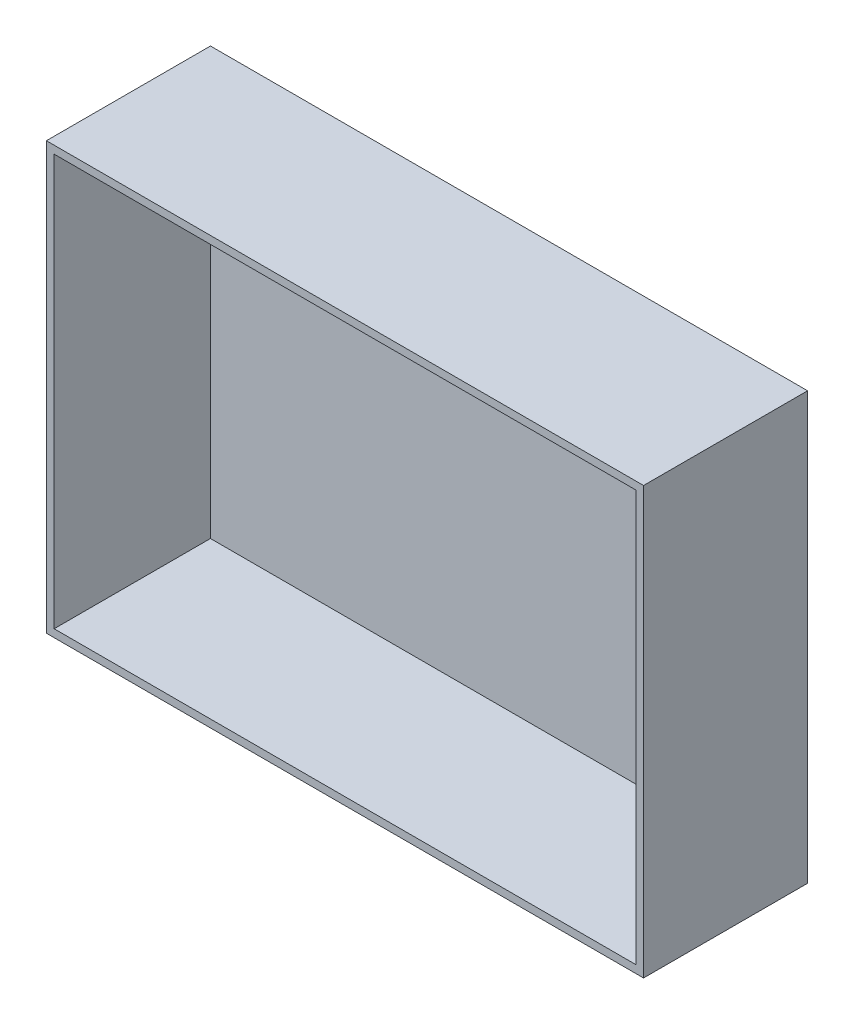
from build123d import *

# Parameters (mm, degrees)
SKETCH1_W           = 231.14
SKETCH1_H           = 165.1
BOSS_EXTRUDE1_DEPTH = 63.5
SKETCH2_OUTSIDE_W   = 291.352
SKETCH2_OUTSIDE_H   = 225.312
SKETCH2_OUTSIDE_W_2 = 231.14
SKETCH2_OUTSIDE_H_2 = 165.1
SKETCH2_OUTSIDE_W_3 = 225.14
SKETCH2_OUTSIDE_H_3 = 159.1
CUT_EXTRUDE1_DEPTH  = 60.5


with BuildPart() as part:
    # Sketch1 → Boss-Extrude1 (new body)
    with BuildSketch(Plane.XY):
        with Locations((115.57, 82.55)):
            Rectangle(SKETCH1_W, SKETCH1_H)
    extrude(amount=BOSS_EXTRUDE1_DEPTH)

    # Sketch2 outside → Cut-Extrude1 (cut)
    # profile 1 of 2: a face of its own
    with BuildSketch(Plane.XY.offset(63.5)):
        with Locations((115.57, 82.55)):
            Rectangle(SKETCH2_OUTSIDE_W, SKETCH2_OUTSIDE_H)
        with Locations((115.57, 82.55)):
            Rectangle(SKETCH2_OUTSIDE_W_2, SKETCH2_OUTSIDE_H_2, mode=Mode.SUBTRACT)
    # profile 2 of 2: a face of its own
    with BuildSketch(Plane.XY.offset(63.5)):
        with Locations((115.57, 82.55)):
            Rectangle(SKETCH2_OUTSIDE_W_3, SKETCH2_OUTSIDE_H_3)
    extrude(amount=-CUT_EXTRUDE1_DEPTH, mode=Mode.SUBTRACT)


solid = part.part
